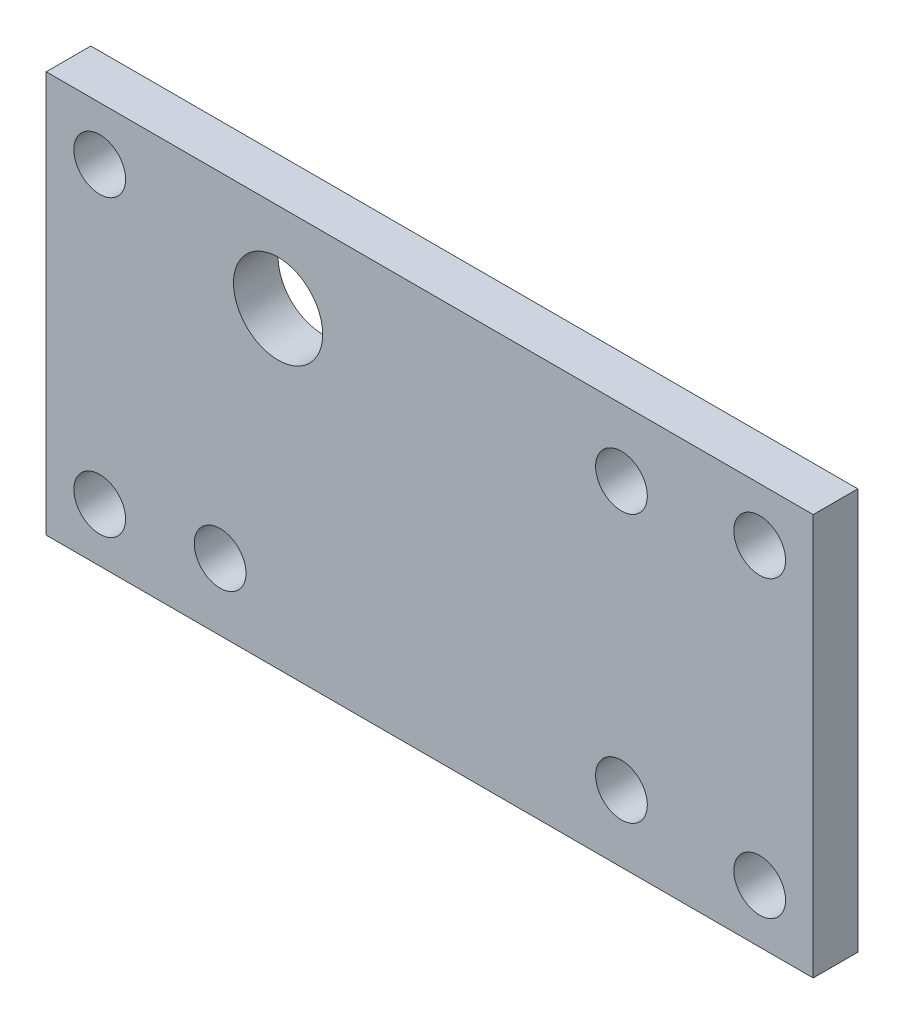
from build123d import *

# Parameters (mm, degrees)
SKETCH1_W           = 54.61
SKETCH1_H           = 28.575
SKETCH1_R           = 3.175
BOSS_EXTRUDE1_DEPTH = 3.175
SKETCH2_R           = 1.8415
CUT_EXTRUDE1_DEPTH  = 31.980256717
SKETCH4_R           = 1.8415
CUT_EXTRUDE2_DEPTH  = 31.980256717
SKETCH5_R           = 1.8415
CUT_EXTRUDE3_DEPTH  = 31.980256717


with BuildPart() as part:
    # Sketch1 → Boss-Extrude1 (new body)
    with BuildSketch(Plane.XY):
        Rectangle(SKETCH1_W, SKETCH1_H)
        with Locations((-10.795, 7.9375)):
            Circle(SKETCH1_R, mode=Mode.SUBTRACT)
    extrude(amount=BOSS_EXTRUDE1_DEPTH)

    # Sketch2 → Cut-Extrude1 (cut, through all)
    with BuildSketch(Plane.XY.offset(3.175)):
        with Locations((-23.495, 10.4775)):
            Circle(SKETCH2_R)
        with Locations((-23.495, -10.4775)):
            Circle(SKETCH2_R)
        with Locations((23.495, -10.4775)):
            Circle(SKETCH2_R)
        with Locations((23.495, 10.4775)):
            Circle(SKETCH2_R)
    extrude(amount=-CUT_EXTRUDE1_DEPTH, mode=Mode.SUBTRACT)

    # Sketch4 → Cut-Extrude2 (cut, through all)
    with BuildSketch(Plane.XY.offset(3.175)):
        with Locations((13.6525, 9.525)):
            Circle(SKETCH4_R)
    extrude(amount=-CUT_EXTRUDE2_DEPTH, mode=Mode.SUBTRACT)

    # Sketch5 → Cut-Extrude3 (cut, through all)
    with BuildSketch(Plane.XY.offset(3.175)):
        with Locations((-14.9225, -9.525)):
            Circle(SKETCH5_R)
        with Locations((13.6525, -9.525)):
            Circle(SKETCH5_R)
    extrude(amount=-CUT_EXTRUDE3_DEPTH, mode=Mode.SUBTRACT)


solid = part.part
